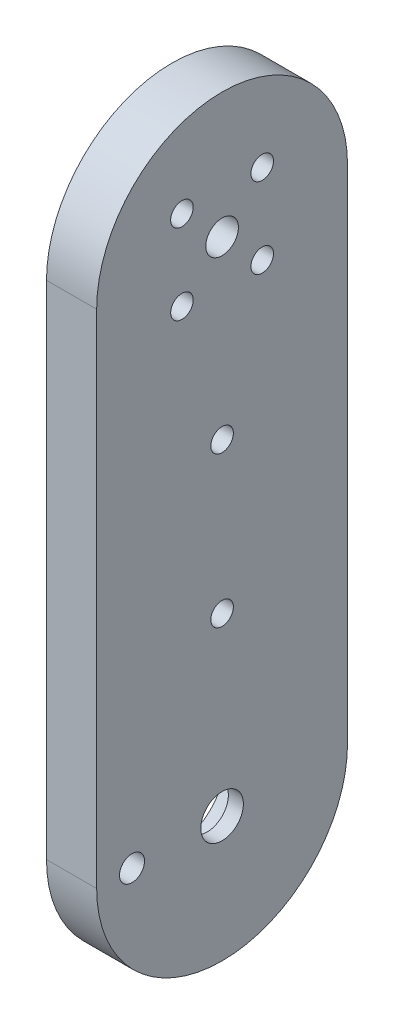
from build123d import *

# Parameters (mm, degrees)
CROQUIS1_R              = 3.25
CROQUIS1_R_2            = 2.25
SALIENTE_EXTRUIR1_DEPTH = 10
SALIENTE_EXTRUIR2_DEPTH = 10
CROQUIS3_R              = 2.25
CORTAR_EXTRUIR1_DEPTH   = 128.867118525
CROQUIS4_R              = 10.9
CORTAR_EXTRUIR2_DEPTH   = 7
CROQUIS5_R              = 4.25
CORTAR_EXTRUIR3_DEPTH   = 128.667536986
CROQUIS6_R              = 2.5
CORTAR_EXTRUIR4_DEPTH   = 128.867118525


with BuildPart() as part:
    # Croquis1 → Saliente-Extruir1 (new body)
    with BuildSketch(Plane(origin=(0, 0, 0), x_dir=(0, 0, -1), z_dir=(1, 0, 0))):
        with BuildLine():
            Line((-25, 0), (-25, -85))
            Line((-25, -85), (25, -85))
            Line((25, -85), (25, 0))
            ThreePointArc((25, 0), (0, 25), (-25, 0))
        make_face()
        Circle(CROQUIS1_R, mode=Mode.SUBTRACT)
        with Locations((-8, 8)):
            Circle(CROQUIS1_R_2, mode=Mode.SUBTRACT)
        with Locations((8, 8)):
            Circle(CROQUIS1_R_2, mode=Mode.SUBTRACT)
        with Locations((8, -8)):
            Circle(CROQUIS1_R_2, mode=Mode.SUBTRACT)
        with Locations((-8, -8)):
            Circle(CROQUIS1_R_2, mode=Mode.SUBTRACT)
    extrude(amount=SALIENTE_EXTRUIR1_DEPTH)

    # Croquis2 → Saliente-Extruir2 (add)
    with BuildSketch(Plane(origin=(10, 0, 0), x_dir=(0, 0, -1), z_dir=(1, 0, 0))):
        with BuildLine():
            Line((-25, -100), (-25, -85))
            Line((-25, -85), (25, -85))
            Line((25, -85), (25, -100))
            ThreePointArc((25, -100), (0, -125), (-25, -100))
        make_face()
    extrude(amount=-SALIENTE_EXTRUIR2_DEPTH)

    # Croquis3 → Cortar-Extruir1 (cut, through all)
    with BuildSketch(Plane.ZY):
        with Locations((0, -35)):
            Circle(CROQUIS3_R)
        with Locations((0, -65)):
            Circle(CROQUIS3_R)
    extrude(amount=-CORTAR_EXTRUIR1_DEPTH, mode=Mode.SUBTRACT)

    # Croquis4 → Cortar-Extruir2 (cut)
    with BuildSketch(Plane.ZY):
        with Locations((0, -100)):
            Circle(CROQUIS4_R)
    extrude(amount=-CORTAR_EXTRUIR2_DEPTH, mode=Mode.SUBTRACT)

    # Croquis5 → Cortar-Extruir3 (cut, through all)
    with BuildSketch(Plane.ZY.offset(-7)):
        with Locations((0, -100)):
            Circle(CROQUIS5_R)
    extrude(amount=-CORTAR_EXTRUIR3_DEPTH, mode=Mode.SUBTRACT)

    # Croquis6 → Cortar-Extruir4 (cut, through all)
    with BuildSketch(Plane.ZY):
        with Locations((17.95, -100)):
            Circle(CROQUIS6_R)
    extrude(amount=-CORTAR_EXTRUIR4_DEPTH, mode=Mode.SUBTRACT)


solid = part.part
